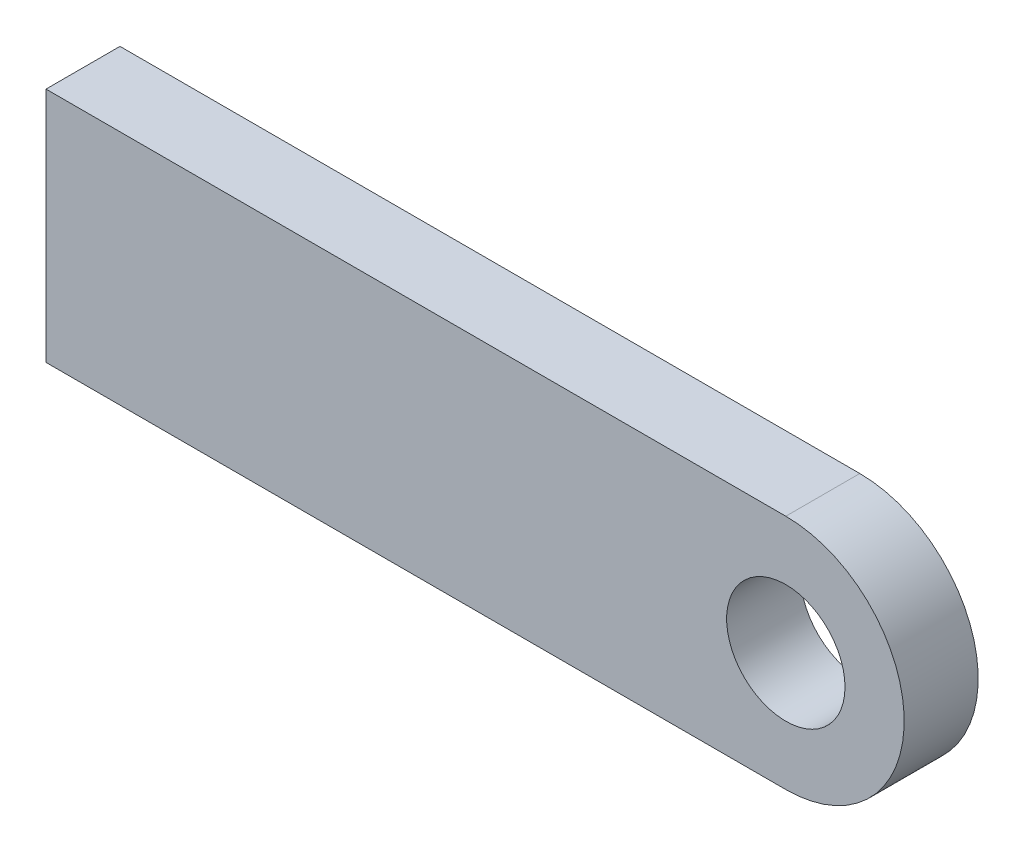
from build123d import *

# Parameters (mm, degrees)
SKETCH1_R           = 4
BOSS_EXTRUDE1_DEPTH = 5
SKETCH2_W           = 5
SKETCH2_H           = 16
CUT_EXTRUDE1_DEPTH  = 59.762232769
SKETCH3_R           = 2
CUT_EXTRUDE3_DEPTH  = 5


with BuildPart() as part:
    # Sketch1 → Boss-Extrude1 (new body)
    with BuildSketch(Plane.XY):
        with BuildLine():
            Line((-50, -8), (50, -8))
            ThreePointArc((50, -8), (58, 0), (50, 8))
            Line((50, 8), (-50, 8))
            ThreePointArc((-50, 8), (-58, 0), (-50, -8))
        make_face()
        with Locations((-50, 0)):
            Circle(SKETCH1_R, mode=Mode.SUBTRACT)
        with Locations((50, 0)):
            Circle(SKETCH1_R, mode=Mode.SUBTRACT)
    extrude(amount=BOSS_EXTRUDE1_DEPTH)

    # Sketch2 → Cut-Extrude1 (cut, through all)
    with BuildSketch(Plane(origin=(0, 0, 0), x_dir=(0, 0, -1), z_dir=(1, 0, 0))):
        with Locations((-2.5, 0)):
            Rectangle(SKETCH2_W, SKETCH2_H)
    extrude(amount=-CUT_EXTRUDE1_DEPTH, mode=Mode.SUBTRACT)

    # Sketch3 → Cut-Extrude3 (cut)
    with BuildSketch(Plane.ZY):
        with Locations((2.5, 0)):
            Circle(SKETCH3_R)
    extrude(amount=-CUT_EXTRUDE3_DEPTH, mode=Mode.SUBTRACT)


solid = part.part
